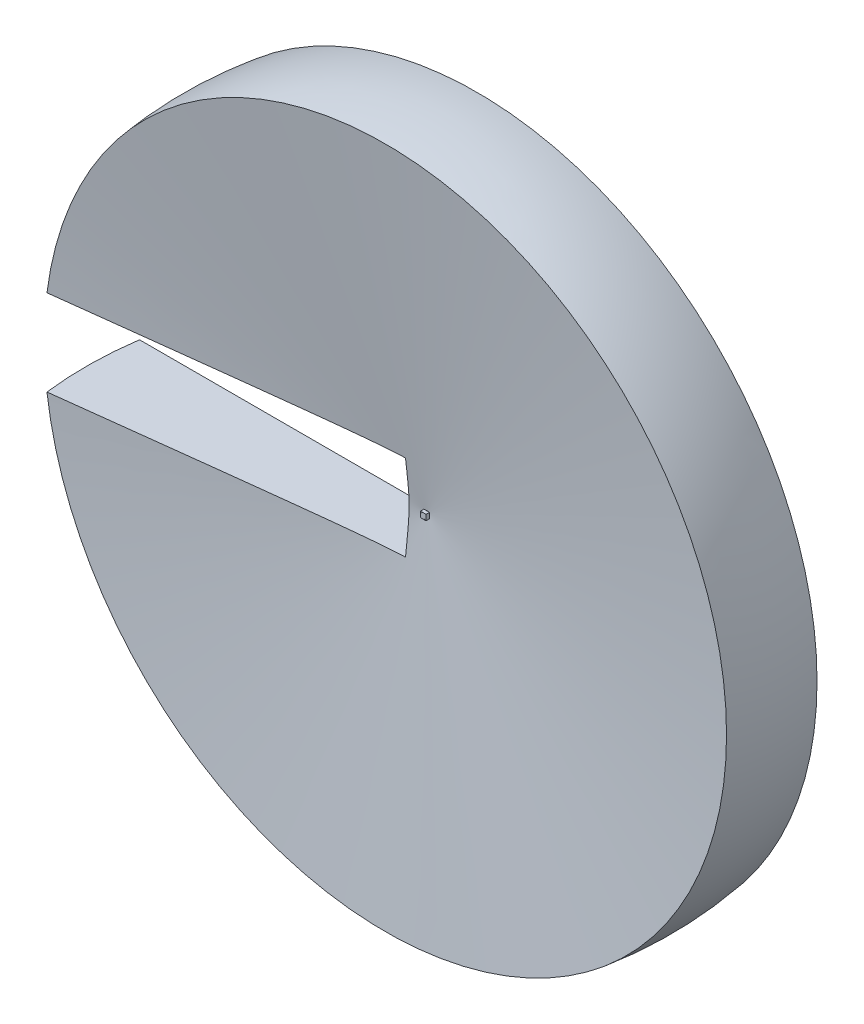
from build123d import *

# Parameters (mm, degrees)
SCHIZZO1_W                    = 65
SCHIZZO1_H                    = 65
ESTRUSIONE_ESTRUSIONE1_DEPTH  = 39.5
TAGLIO_ESTRUSIONE6_DEPTH      = 5821.887808239
FORO_PER_VITE_M3_1_AT_2_COUNT = 2
FORO_PER_VITE_M3_1_AT_2_PITCH = 36
FORO_PER_VITE_M3_1_AT_3_COUNT = 2
FORO_PER_VITE_M3_1_AT_3_PITCH = 60
FORO_PER_VITE_M3_1_AT_4_COUNT = 2
FORO_PER_VITE_M3_1_AT_4_PITCH = 48


with BuildPart() as part:
    # Schizzo1 → Estrusione-Estrusione1 (new body)
    with BuildSketch(Plane.XY):
        Rectangle(SCHIZZO1_W, SCHIZZO1_H)
    extrude(amount=ESTRUSIONE_ESTRUSIONE1_DEPTH)

    # Schizzo2 → Rivoluzione1 (revolve)
    with BuildSketch(Plane(origin=(0, 0, 0), x_dir=(1, 0, 0), z_dir=(0, 1, 0))):
        with BuildLine():
            Line((0, 0), (0, 20.5))
            Line((0, 20.5), (12.479983974, 20.5))
            ThreePointArc((12.479983974, 20.5), (20.922710333, 11.757558943), (24, 0))
            Line((24, 0), (0, 0))
        make_face()
    revolve(axis=Axis((0, 0, 0), (0, 0, -1)))

    # Schizzo10 → Foro per Vite M3-1 (revolve, cut)
    with BuildSketch(Plane(origin=(18, 24, 39.5), x_dir=(0, -1, 0), z_dir=(1, 0, 0))):
        Polygon((0, 0), (0, 20.96137699), (1.6, 20), (1.6, 0), align=None)
    foro_per_vite_m3_1 = revolve(axis=Axis((18, 24, 45.85), (0, 0, -1)), mode=Mode.SUBTRACT)

    # Foro per Vite M3-1 at 2: Foro per Vite M3-1 ×2
    with Locations(*[(-i * FORO_PER_VITE_M3_1_AT_2_PITCH, 0, 0) for i in range(1, FORO_PER_VITE_M3_1_AT_2_COUNT)]):
        add(foro_per_vite_m3_1, mode=Mode.SUBTRACT)

    # Foro per Vite M3-1 at 3: Foro per Vite M3-1 ×2
    with Locations(*[Vector(-0.5999999999999999, -0.8, 0) * (i * FORO_PER_VITE_M3_1_AT_3_PITCH) for i in range(1, FORO_PER_VITE_M3_1_AT_3_COUNT)]):
        add(foro_per_vite_m3_1, mode=Mode.SUBTRACT)

    # Foro per Vite M3-1 at 4: Foro per Vite M3-1 ×2
    with Locations(*[(0, -i * FORO_PER_VITE_M3_1_AT_4_PITCH, 0) for i in range(1, FORO_PER_VITE_M3_1_AT_4_COUNT)]):
        add(foro_per_vite_m3_1, mode=Mode.SUBTRACT)


with BuildPart() as body_2:
    # Schizzo5 → Rivoluzione5 (revolve)
    with BuildSketch(Plane(origin=(0, 0, 0), x_dir=(1, 0, 0), z_dir=(0, 1, 0))):
        with BuildLine():
            Line((32.5, 3.509501771), (3970.184606565, -479.977373621))
            ThreePointArc((3970.184606565, -479.977373621), (3999.74044582, 53.06715998), (3958.048402938, 585.3))
            Line((3958.048402938, 585.3), (451.426834996, 585.3))
            Line((451.426834996, 585.3), (20.15926203, 33.302678747))
            ThreePointArc((20.15926203, 33.302678747), (30.251575463, 20.03061284), (32.5, 3.509501771))
        make_face()
    revolve(axis=Axis((0, 0, 992.5), (0, 0, -1)))

    # Schizzo7 → Taglio-Estrusione6 (cut, through all)
    with BuildSketch(Plane(origin=(-188.097275149, 0, 0), x_dir=(0, 0, -1), z_dir=(1, 0, 0))):
        Polygon((585.3, -500), (585.3, 500), (60.5, 500), (-139.5, 500), (-489.5, 500), (-489.5, -500), (-139.5, -500), (60.5, -500), align=None)
    extrude(amount=-TAGLIO_ESTRUSIONE6_DEPTH, mode=Mode.SUBTRACT)


solid = Compound([part.part, body_2.part])
